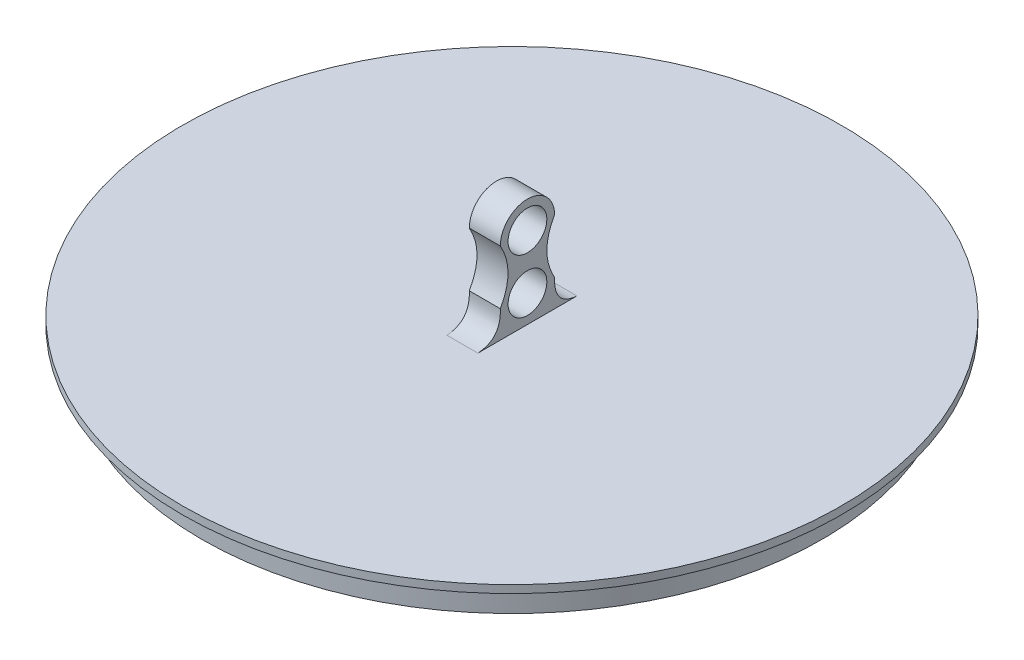
from build123d import *

# Parameters (mm, degrees)
SKETCH_3_R           = 40
EXTRUDE_1_DEPTH      = 4
SKETCH_4_R           = 42.5
EXTRUDE_2_DEPTH      = 1
EXTRUDE_3_DEPTH      = 2
EXTRUDE_3_DEPTH_BACK = 2
SKETCH_5_R           = 2.5


with BuildPart() as part:
    # Эскиз3 → Бобышка-Вытянуть1 (new body)
    with BuildSketch(Plane(origin=(0, 0, 0), x_dir=(1, 0, 0), z_dir=(0, 1, 0))):
        Circle(SKETCH_3_R)
    extrude(amount=EXTRUDE_1_DEPTH)

    # Эскиз4 → Бобышка-Вытянуть2 (add)
    with BuildSketch(Plane(origin=(0, 4, 0), x_dir=(1, 0, 0), z_dir=(0, 1, 0))):
        Circle(SKETCH_4_R)
    extrude(amount=EXTRUDE_2_DEPTH)

    # Эскиз5 → Бобышка-Вытянуть3 (add, two sides: drawn at the far end of the back side and taken through both)
    with BuildSketch(Plane(origin=(0, 0, 0), x_dir=(0, 0, -1), z_dir=(1, 0, 0)).offset(-EXTRUDE_3_DEPTH_BACK)):
        with BuildLine():
            add(Edge.make_bspline(
                [(-3.5, 8.517823555), (-3.350300092, 5.23093062), (-6.389981791, 5)],
                knots=[0, 0, 0, 0.868708242, 0.868708242, 0.868708242], degree=2))
            Line((-6.389981791, 5), (6.389981791, 5))
            add(Edge.make_bspline(
                [(3.5, 8.517823555), (3.350300092, 5.23093062), (6.389981791, 5)],
                knots=[0, 0, 0, 0.868708242, 0.868708242, 0.868708242], degree=2))
            add(Edge.make_bspline(
                [(3.5, 15.517823555), (1.510674253, 12.017823555), (3.5, 8.517823555)],
                knots=[0, 0, 0, 1, 1, 1], degree=2))
            ThreePointArc((3.5, 15.517823555), (0, 19.017823555), (-3.5, 15.517823555))
            add(Edge.make_bspline(
                [(-3.5, 15.517823555), (-1.510674253, 12.017823555), (-3.5, 8.517823555)],
                knots=[0, 0, 0, 1, 1, 1], degree=2))
        make_face()
        with Locations((0, 8.517823555)):
            Circle(SKETCH_5_R, mode=Mode.SUBTRACT)
        with Locations((0, 15.517823555)):
            Circle(SKETCH_5_R, mode=Mode.SUBTRACT)
    extrude(amount=EXTRUDE_3_DEPTH + EXTRUDE_3_DEPTH_BACK)


solid = part.part
